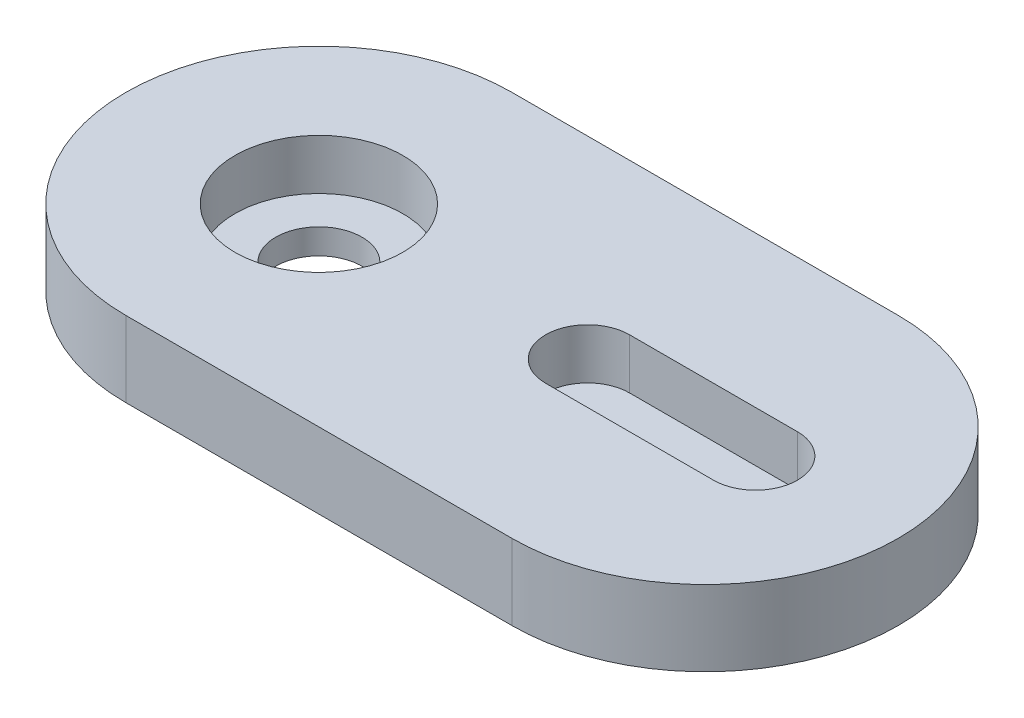
from build123d import *

# Parameters (mm, degrees)
BOSS_EXTRUDE1_DEPTH = 2.8575
SKETCH2_R           = 1.63195
CUT_EXTRUDE1_DEPTH  = 3.048
SKETCH3_R           = 3.175
CUT_EXTRUDE2_DEPTH  = 1.905


with BuildPart() as part:
    # Sketch1 → Boss-Extrude1 (new body)
    with BuildSketch(Plane(origin=(0, 0, 0), x_dir=(1, 0, 0), z_dir=(0, 1, 0))):
        with BuildLine():
            Line((14.605, 7.3025), (0, 7.3025))
            ThreePointArc((0, 7.3025), (-7.3025, 0), (0, -7.3025))
            Line((0, -7.3025), (14.605, -7.3025))
            ThreePointArc((14.605, -7.3025), (21.9075, 0), (14.605, 7.3025))
        make_face()
    extrude(amount=BOSS_EXTRUDE1_DEPTH)

    # Sketch2 → Cut-Extrude1 (cut)
    with BuildSketch(Plane(origin=(0, 2.8575, 0), x_dir=(1, 0, 0), z_dir=(0, 1, 0))):
        with Locations(Location((0, 0, 0), (0, 0, 270))):
            Circle(SKETCH2_R)
    extrude(amount=-CUT_EXTRUDE1_DEPTH, mode=Mode.SUBTRACT)

    # Sketch3 → Cut-Extrude2 (cut)
    with BuildSketch(Plane(origin=(0, 2.8575, 0), x_dir=(1, 0, 0), z_dir=(0, 1, 0))):
        with Locations(Location((0, 0, 0), (0, 0, 270))):
            Circle(SKETCH3_R)
        with BuildLine():
            Line((10.16, 1.5875), (16.51, 1.5875))
            ThreePointArc((16.51, 1.5875), (18.0975, 0), (16.51, -1.5875))
            Line((16.51, -1.5875), (10.16, -1.5875))
            ThreePointArc((10.16, -1.5875), (8.5725, 0), (10.16, 1.5875))
        make_face()
    extrude(amount=-CUT_EXTRUDE2_DEPTH, mode=Mode.SUBTRACT)


solid = part.part
